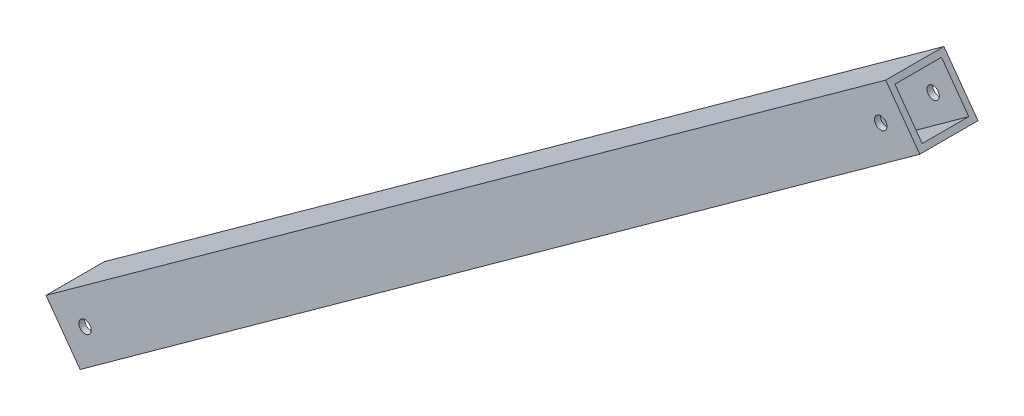
from build123d import *

# Parameters (mm, degrees)
SKETCH_2_R          = 1.6
EXTRUDE_1_DEPTH     = 15
SKETCH_3_W          = 12
SKETCH_3_H          = 12
CUT_EXTRUDE_1_DEPTH = 275.381172618


with BuildPart() as part:
    # ｽｹｯﾁ2 → ﾎﾞｽ - 押し出し1 (new body)
    with BuildSketch(Plane.XY):
        Polygon((-10.065580607, 1.98345331), (-1.285388486, -10.17829929), (215.065580607, 146.01654669), (206.285388486, 158.17829929), align=None)
        Circle(SKETCH_2_R, mode=Mode.SUBTRACT)
        with Locations((205, 148)):
            Circle(SKETCH_2_R, mode=Mode.SUBTRACT)
    extrude(amount=EXTRUDE_1_DEPTH)

    # ｽｹｯﾁ3 → ｶｯﾄ - 押し出し1 (cut, through all)
    with BuildSketch(Plane(origin=(210.675484547, 152.09742299, 0), x_dir=(0, 0, -1), z_dir=(0.8107835066939648, 0.5853461414180824, 0))):
        with Locations((-7.5, 0)):
            Rectangle(SKETCH_3_W, SKETCH_3_H)
    extrude(amount=-CUT_EXTRUDE_1_DEPTH, mode=Mode.SUBTRACT)


solid = part.part
